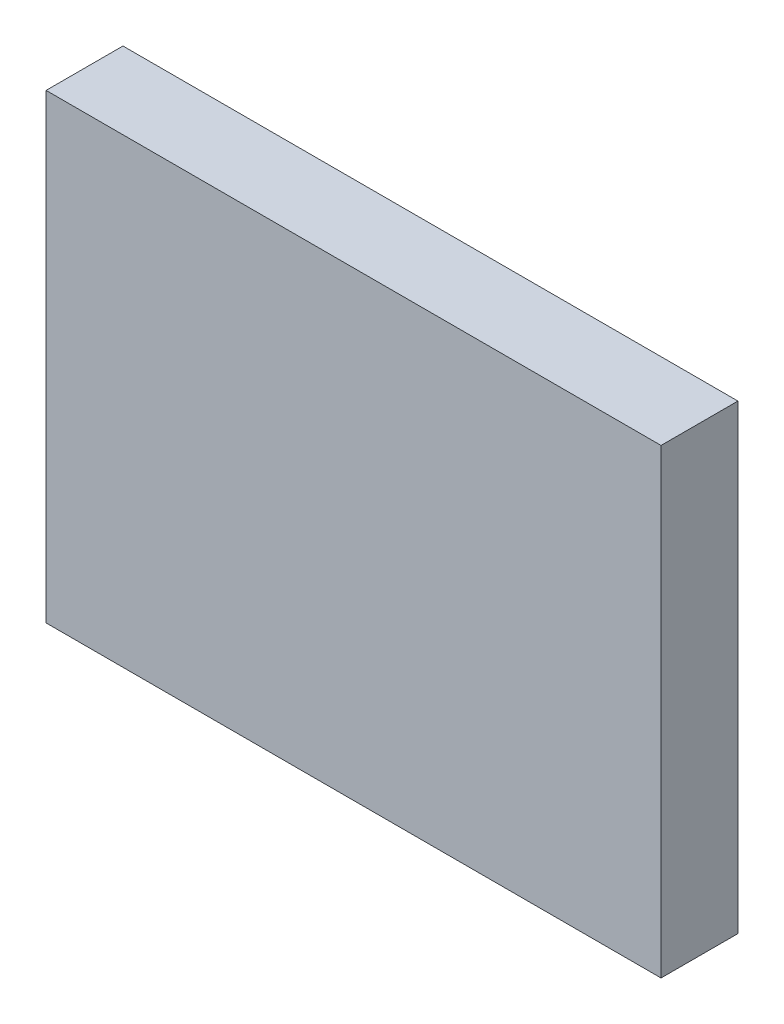
from build123d import *

# Parameters (mm, degrees)
SKETCH1_W           = 101.6
SKETCH1_H           = 76.2
BOSS_EXTRUDE1_DEPTH = 12.7


with BuildPart() as part:
    # Sketch1 → Boss-Extrude1 (new body)
    with BuildSketch(Plane.XY):
        with Locations((50.8, 38.1)):
            Rectangle(SKETCH1_W, SKETCH1_H)
    extrude(amount=BOSS_EXTRUDE1_DEPTH)


solid = part.part
